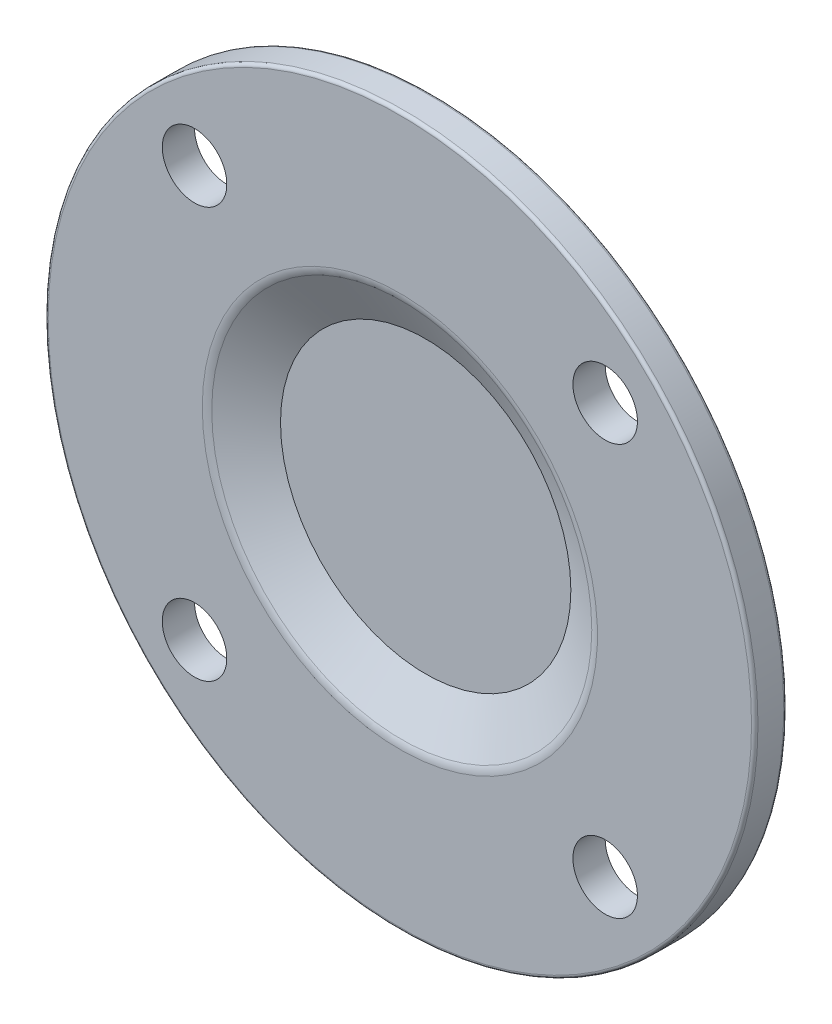
from build123d import *

# Parameters (mm, degrees)
FILLET1_R          = 0.5
SKETCH2_R          = 1
CUT_EXTRUDE1_DEPTH = 16.588457268
FILLET2_R          = 0.1


with BuildPart() as part:
    # Sketch1 → Revolve1 (revolve)
    with BuildSketch(Plane(origin=(0, 0, 0), x_dir=(0, 0, -1), z_dir=(1, 0, 0)), mode=Mode.PRIVATE) as revolve1_sk:
        Polygon((0, 11), (0, 6), (0.8, 4.5), (0.8, 0), (1.8, 0), (1.8, 4.5), (1, 6), (1, 11), align=None)
    revolve(revolve1_sk.sketch.rotate(Axis((0, 0, 0), (0, 0, -1)), 90), axis=Axis((0, 0, 0), (0, 0, -1)))

    # Fillet1
    fillet1_edges = [part.edges().sort_by_distance(p)[0] for p in [
        (-6, 0, 0),
        (-4.5, 0, -1.8),
        (-6, 0, -1),
    ]]
    fillet(fillet1_edges, radius=FILLET1_R)

    # Sketch2 → Cut-Extrude1 (cut, through all)
    with BuildSketch(Plane(origin=(0, 0, -1), x_dir=(-1, 0, 0), z_dir=(0, 0, -1))):
        with Locations((6.363961031, 6.363961031)):
            Circle(SKETCH2_R)
        with Locations((6.363961031, -6.363961031)):
            Circle(SKETCH2_R)
        with Locations((-6.363961031, -6.363961031)):
            Circle(SKETCH2_R)
        with Locations((-6.363961031, 6.363961031)):
            Circle(SKETCH2_R)
    extrude(amount=-CUT_EXTRUDE1_DEPTH, mode=Mode.SUBTRACT)

    # Fillet2
    fillet2_edges = [part.edges().sort_by_distance(p)[0] for p in [
        (-11, 0, -1),
        (-11, 0, 0),
    ]]
    fillet(fillet2_edges, radius=FILLET2_R)


solid = part.part
